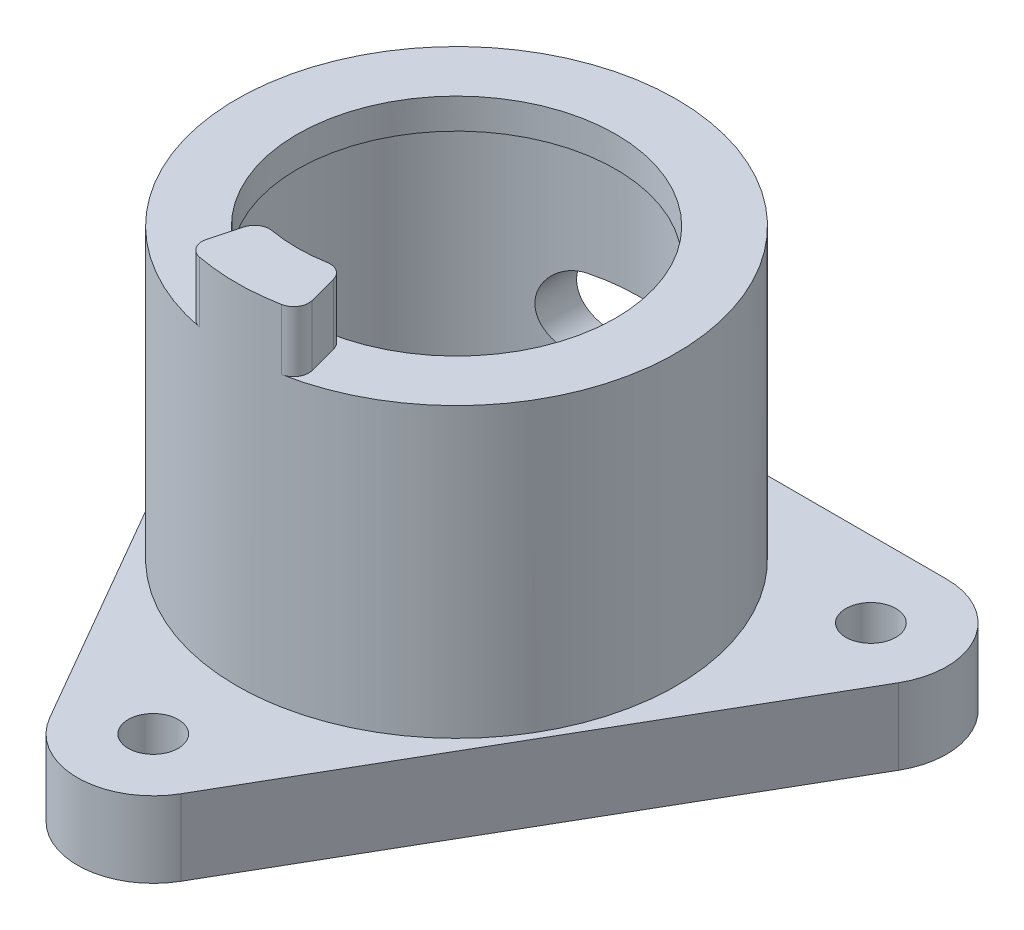
from build123d import *

# Parameters (mm, degrees)
SKETCH_1_R          = 12
EXTRUDE_4_DEPTH     = 5
SKETCH_6_R          = 14.5
SKETCH_6_R_2        = 12
EXTRUDE_5_DEPTH     = 17
SKETCH_7_R          = 14.5
SKETCH_7_R_2        = 10.5
EXTRUDE_6_DEPTH     = 2
EXTRUDE_7_DEPTH     = 4
CUT_EXTRUDE_3_DEPTH = 44.671559
HOLE_WIZARD_M4_1_D  = 3.3


with BuildPart() as part:
    # 草图1 → 凸台-拉伸4 (new body)
    with BuildSketch(Plane(origin=(0, 0, 0), x_dir=(1, 0, 0), z_dir=(0, 1, 0))):
        with BuildLine():
            Line((-21.650635, 7.5), (-4.330127, -22.5))
            ThreePointArc((-4.330127, -22.5), (0, -25), (4.330127, -22.5))
            Line((4.330127, -22.5), (21.650635, 7.5))
            ThreePointArc((21.650635, 7.5), (21.650635, 12.5), (17.320508, 15))
            Line((17.320508, 15), (-17.320508, 15))
            ThreePointArc((-17.320508, 15), (-21.650635, 12.5), (-21.650635, 7.5))
        make_face()
        with Locations(Location((0, 0, 0), (0, 0, 270))):
            Circle(SKETCH_1_R, mode=Mode.SUBTRACT)
    extrude(amount=EXTRUDE_4_DEPTH)

    # 草图6 → 凸台-拉伸5 (add)
    with BuildSketch(Plane(origin=(0, 5, 0), x_dir=(1, 0, 0), z_dir=(0, 1, 0))):
        with Locations(Location((0, 0, 0), (0, 0, 270))):
            Circle(SKETCH_6_R)
        with Locations(Location((0, 0, 0), (0, 0, 270))):
            Circle(SKETCH_6_R_2, mode=Mode.SUBTRACT)
    extrude(amount=EXTRUDE_5_DEPTH)

    # 草图7 → 凸台-拉伸6 (add)
    with BuildSketch(Plane(origin=(0, 22, 0), x_dir=(1, 0, 0), z_dir=(0, 1, 0))):
        with Locations(Location((0, 0, 0), (0, 0, 270))):
            Circle(SKETCH_7_R)
        with Locations(Location((0, 0, 0), (0, 0, 270))):
            Circle(SKETCH_7_R_2, mode=Mode.SUBTRACT)
    extrude(amount=EXTRUDE_6_DEPTH)

    # 草图8 → 凸台-拉伸7 (add)
    with BuildSketch(Plane(origin=(0, 24, 0), x_dir=(1, 0, 0), z_dir=(0, 1, 0))):
        with BuildLine():
            Line((2.965145, -11.066071), (3.484458, -13.004174))
            ThreePointArc((3.484458, -13.004174), (3.365431, -13.794747), (2.70509, -14.245437))
            ThreePointArc((2.70509, -14.245437), (0, -14.5), (-2.70509, -14.245437))
            ThreePointArc((-2.70509, -14.245437), (-3.365431, -13.794747), (-3.484458, -13.004174))
            Line((-3.484458, -13.004174), (-2.965145, -11.066071))
            ThreePointArc((-2.965145, -11.066071), (-2.536434, -10.481444), (-1.825374, -10.340117))
            ThreePointArc((-1.825374, -10.340117), (0, -10.5), (1.825374, -10.340117))
            ThreePointArc((1.825374, -10.340117), (2.536434, -10.481444), (2.965145, -11.066071))
        make_face()
    extrude(amount=EXTRUDE_7_DEPTH)

    # 草图9 → 切除-拉伸3 (cut, through all)
    with BuildSketch(Plane.XY):
        with BuildLine():
            Line((-3, 14), (3, 14))
            ThreePointArc((3, 14), (5.5, 11.5), (3, 9))
            Line((3, 9), (-3, 9))
            ThreePointArc((-3, 9), (-5.5, 11.5), (-3, 14))
        make_face()
    extrude(amount=-CUT_EXTRUDE_3_DEPTH, mode=Mode.SUBTRACT)

    # M4 螺纹孔1 (through all)
    with Locations(Plane(origin=(0, 5, 20), x_dir=(0, 0, 1), z_dir=(0, 1, 0))):
        with Locations((0, 0), (-30, 17.320508), (-30, -17.320508)):
            Hole(HOLE_WIZARD_M4_1_D / 2)


solid = part.part
